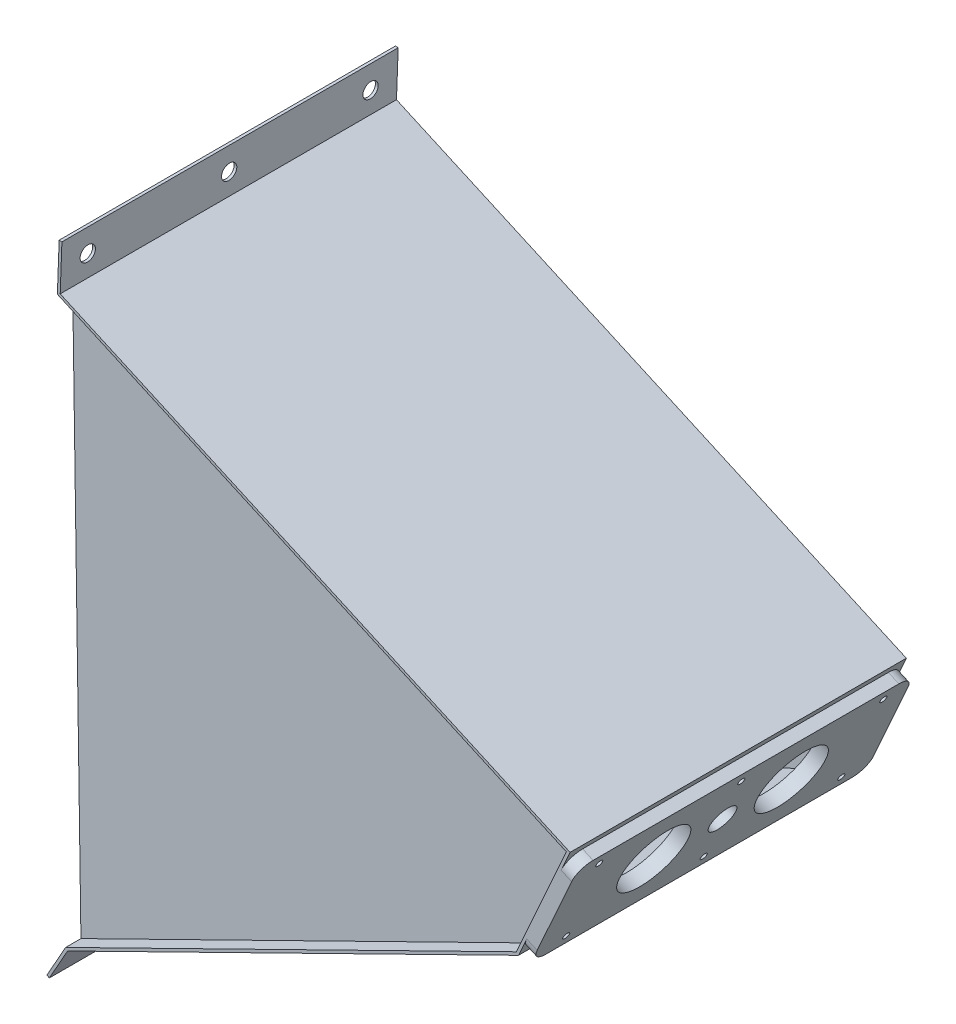
from build123d import *

# Parameters (mm, degrees)
EXTRUDE_THIN1_0_090_DEPTH       = 139.7
BE_00_FRONT_BEARING_PLATE_DEPTH = 9.525
SKETCH10_R                      = 2.7813
SKETCH10_R_2                    = 11.1125
SKETCH10_R_3                    = 28.575
CE_00_FRONT_HOLES_DEPTH         = 25.4
SKETCH11_R                      = 6.35
CE_00_UPPOER_HOLES_DEPTH        = 25.4
SKETCH12_R                      = 6.5532
CE_00_LOWER_HOLES_DEPTH         = 12.7
BE_00_START                     = -127
BE_00_SIDE_PANEL_DEPTH          = 3.175


with BuildPart() as part:
    # Sketch9 → Extrude-Thin1 0.090 (new, symmetric)
    with BuildSketch(Plane.XY):
        Polygon((-6.010227149, -332.418181598), (9.55556721, -304.745658294), (384.039485631, -120.64961833), (425.625062176, -27.95010472), (2.683531334, 161.784088268), (4.161010967, 201.456785856), (6.445427335, 201.371710254), (5.025301148, 163.239044684), (428.646476704, -26.800041136), (385.787807265, -122.337439943), (11.200381601, -306.484363998), (-4.017805471, -333.538918792), align=None)
    extrude(amount=EXTRUDE_THIN1_0_090_DEPTH, both=True)

    # Sketch13 → BE-00 Front Bearing Plate (add)
    with BuildSketch(Plane(origin=(366.842913711, -164.56800553, 0), x_dir=(0, 0, -1), z_dir=(0.9123967874925901, -0.40930685576129966, 0))):
        with BuildLine():
            Line((-127, 145.534670176), (127, 145.534670176))
            ThreePointArc((127, 145.534670176), (135.980256121, 141.814926297), (139.7, 132.834670176))
            Line((139.7, 132.834670176), (139.7, 62.984670176))
            ThreePointArc((139.7, 62.984670176), (135.980256121, 54.004414055), (127, 50.284670176))
            Line((127, 50.284670176), (-127, 50.284670176))
            ThreePointArc((-127, 50.284670176), (-135.980256121, 54.004414055), (-139.7, 62.984670176))
            Line((-139.7, 62.984670176), (-139.7, 132.834670176))
            ThreePointArc((-139.7, 132.834670176), (-135.980256121, 141.814926297), (-127, 145.534670176))
        make_face()
    extrude(amount=BE_00_FRONT_BEARING_PLATE_DEPTH)

    # Sketch10 → CE-00 Front Holes (cut)
    with BuildSketch(Plane(origin=(-463.262854861, -2038.249879483, 0), x_dir=(0, 0, -1), z_dir=(-0.9123967874925901, 0.40930685576129966, 0))):
        with Locations(Location((-118.013029727, -2185.318974837, 0), (0, 0, 270))):
            Circle(SKETCH10_R)
        with Locations(Location((0, -2147.218974837, 0), (0, 0, 270))):
            Circle(SKETCH10_R_2)
        with Locations(Location((57.15, -2147.218974837, 0), (0, 0, 270))):
            Circle(SKETCH10_R_3)
        with Locations(Location((114.3, -2109.118974837, 0), (0, 0, 270))):
            Circle(SKETCH10_R)
        with Locations(Location((118.013029727, -2185.318974837, 0), (0, 0, 270))):
            Circle(SKETCH10_R)
        with Locations(Location((0, -2109.118974837, 0), (0, 0, 270))):
            Circle(SKETCH10_R)
        with Locations(Location((0, -2185.318974837, 0), (0, 0, 270))):
            Circle(SKETCH10_R)
        with Locations(Location((-114.3, -2109.118974837, 0), (0, 0, 270))):
            Circle(SKETCH10_R)
        with Locations(Location((-57.15, -2147.218974837, 0), (0, 0, 270))):
            Circle(SKETCH10_R_3)
    extrude(amount=CE_00_FRONT_HOLES_DEPTH, mode=Mode.SUBTRACT)

    # Sketch11 → CE-00 Uppoer Holes (cut)
    with BuildSketch(Plane(origin=(-26.304972354, -678.029043238, 0), x_dir=(0, 0, -1), z_dir=(-0.9993072475406022, 0.037215924183416293, 0))):
        with Locations(Location((-117.475, -860.185852954, 0), (0, 0, 270))):
            Circle(SKETCH11_R)
        with Locations(Location((0, -860.185852954, 0), (0, 0, 270))):
            Circle(SKETCH11_R)
        with Locations(Location((117.475, -860.185852954, 0), (0, 0, 270))):
            Circle(SKETCH11_R)
    extrude(amount=CE_00_UPPOER_HOLES_DEPTH, mode=Mode.SUBTRACT)

    # Sketch12 → CE-00 Lower Holes (cut, symmetric)
    with BuildSketch(Plane(origin=(139.468979542, -78.451300992, 0), x_dir=(0, 0, -1), z_dir=(0.8715755371243086, -0.49026123963298696, 0))):
        with Locations(Location((101.6, -280.036485408, 0), (0, 0, 90))):
            Circle(SKETCH12_R)
        with Locations(Location((50.8, -280.036485408, 0), (0, 0, 90))):
            Circle(SKETCH12_R)
        with Locations(Location((-50.8, -280.036485408, 0), (0, 0, 90))):
            Circle(SKETCH12_R)
        with Locations(Location((-101.6, -280.036485408, 0), (0, 0, 90))):
            Circle(SKETCH12_R)
        with BuildLine():
            Line((-19.05, -253.366485408), (19.05, -253.366485408))
            ThreePointArc((19.05, -253.366485408), (23.540128061, -255.226357347), (25.4, -259.716485408))
            Line((25.4, -259.716485408), (25.4, -304.513722271))
            Line((25.4, -304.513722271), (-25.4, -304.513722271))
            Line((-25.4, -304.513722271), (-25.4, -259.716485408))
            ThreePointArc((-25.4, -259.716485408), (-23.540128061, -255.226357347), (-19.05, -253.366485408))
        make_face()
    extrude(amount=CE_00_LOWER_HOLES_DEPTH, both=True, mode=Mode.SUBTRACT)

    # Sketch14 → BE-00 Side Panel (add)
    with BuildSketch(Plane.XY.offset(BE_00_START)):
        Polygon((2.683531334, 161.784088268), (425.625062176, -27.95010472), (384.039485631, -120.64961833), (9.55556721, -304.745658294), align=None)
    be_00_side_panel = extrude(amount=BE_00_SIDE_PANEL_DEPTH)

    # MI-00 Side Panel: BE-00 Side Panel across plane
    add(be_00_side_panel.mirror(Plane.XY))


solid = part.part
